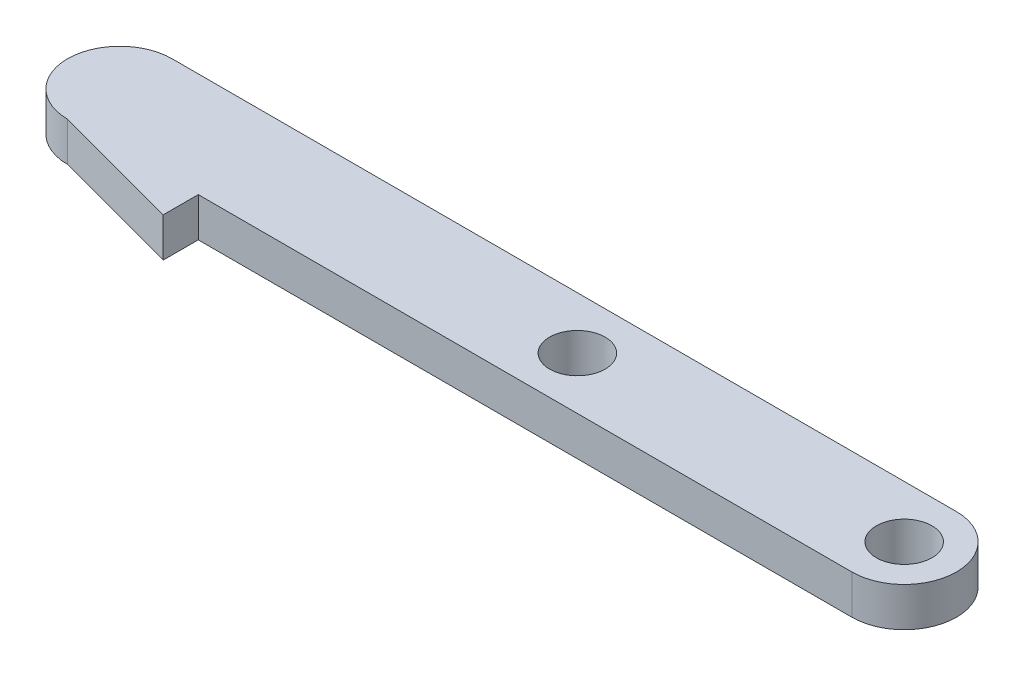
from build123d import *

# Parameters (mm, degrees)
SKETCH1_R           = 2.125
BOSS_EXTRUDE1_DEPTH = 3
BOSS_EXTRUDE2_DEPTH = 3


with BuildPart() as part:
    # Sketch1 → Boss-Extrude1 (new body)
    with BuildSketch(Plane(origin=(0, 0, 0), x_dir=(1, 0, 0), z_dir=(0, 1, 0))):
        with BuildLine():
            Line((-30, 4), (30, 4))
            ThreePointArc((30, 4), (34, 0), (30, -4))
            Line((30, -4), (-30, -4))
            ThreePointArc((-30, -4), (-34, 0), (-30, 4))
        make_face()
        with Locations(Location((30, 0, 0), (0, 0, 270))):
            Circle(SKETCH1_R, mode=Mode.SUBTRACT)
        with Locations(Location((5, 0, 0), (0, 0, 270))):
            Circle(SKETCH1_R, mode=Mode.SUBTRACT)
    extrude(amount=BOSS_EXTRUDE1_DEPTH)

    # Sketch3 → Boss-Extrude2 (add)
    with BuildSketch(Plane.XZ):
        Polygon((-30, 4), (-20, 6.679491924), (-20, 4), align=None)
    extrude(amount=-BOSS_EXTRUDE2_DEPTH)


solid = part.part
